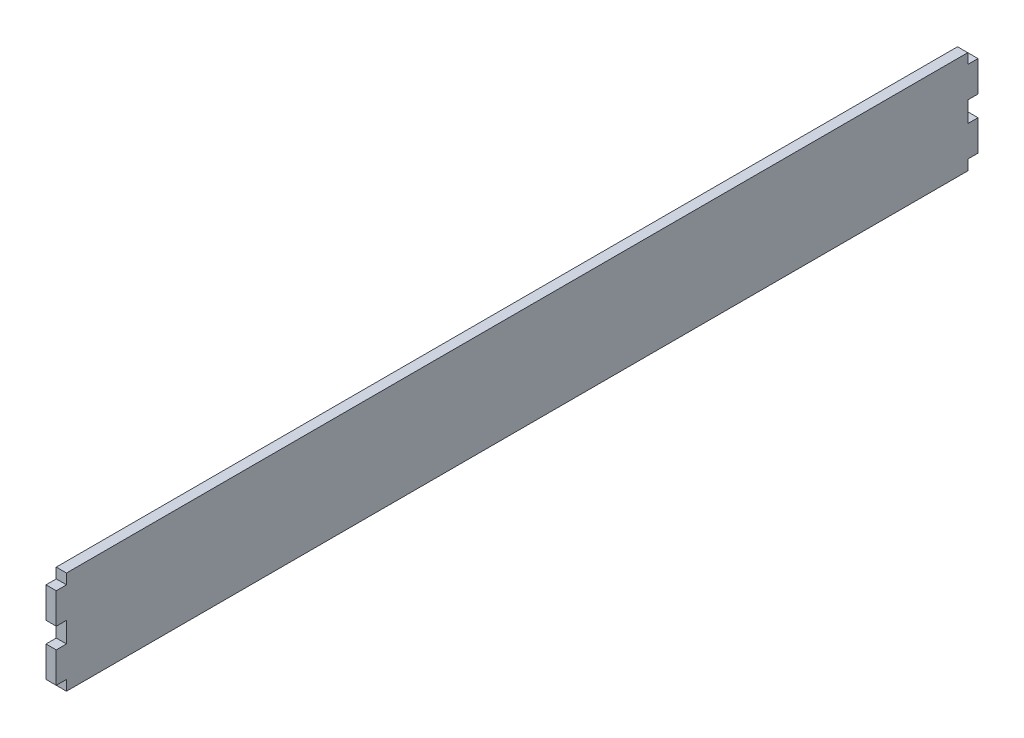
from build123d import *

# Parameters (mm, degrees)
BOSS_EXTRUDE1_DEPTH = 5


with BuildPart() as part:
    # Sketch1 → Boss-Extrude1 (new body)
    with BuildSketch(Plane(origin=(0, 0, 0), x_dir=(0, 0, -1), z_dir=(1, 0, 0))):
        Polygon((225, -5), (225, -20), (220, -20), (220, -25), (-220, -25), (-220, -20), (-225, -20), (-225, -5), (-220, -5), (-220, 5), (-225, 5), (-225, 20), (-220, 20), (-220, 25), (220, 25), (220, 20), (225, 20), (225, 5), (220, 5), (220, -5), align=None)
    extrude(amount=BOSS_EXTRUDE1_DEPTH)


solid = part.part
